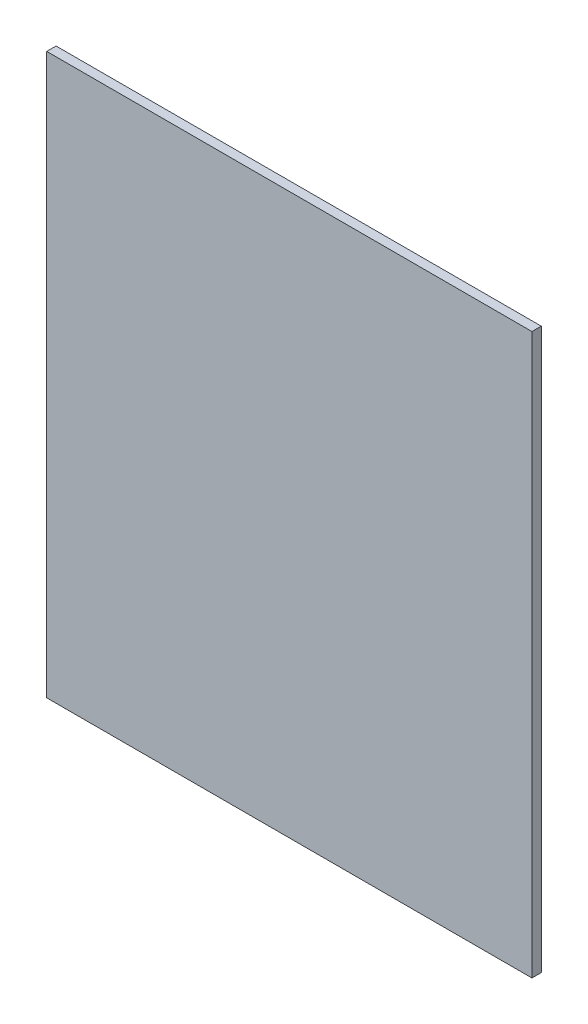
from build123d import *

# Parameters (mm, degrees)
ESQUISSE1_W        = 260
ESQUISSE1_H        = 300
BOSS_EXTRU_1_DEPTH = 5


with BuildPart() as part:
    # Esquisse1 → Boss.-Extru.1 (new body)
    with BuildSketch(Plane.XY):
        Rectangle(ESQUISSE1_W, ESQUISSE1_H)
    extrude(amount=BOSS_EXTRU_1_DEPTH)


solid = part.part
